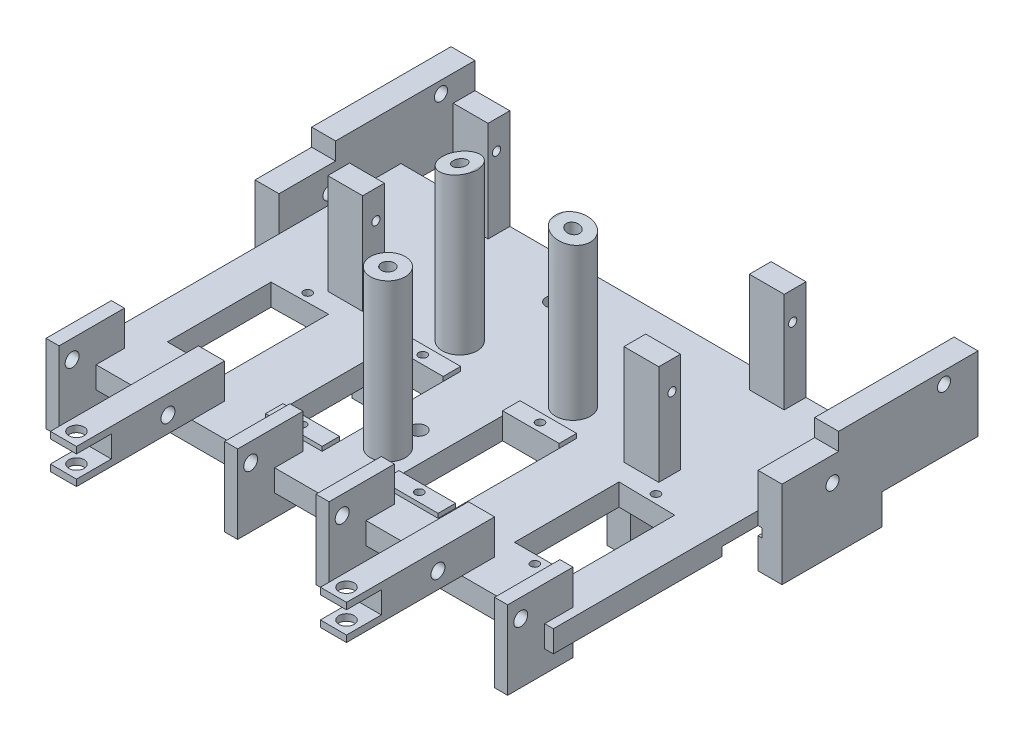
from build123d import *

# Parameters (mm, degrees)
SKETCH_1_W           = 110
SKETCH_1_H           = 75
EXTRUDE_1_DEPTH      = 5
SKETCH_4_W           = 105
SKETCH_4_H           = 28
EXTRUDE_4_DEPTH      = 5
SKETCH_5_W           = 23
SKETCH_5_H           = 20
EXTRUDE_5_DEPTH      = 5.5
SKETCH_6_W           = 32
SKETCH_6_H           = 17
EXTRUDE_6_DEPTH      = 5.5
SKETCH_8_W           = 8
SKETCH_8_H           = 5
EXTRUDE_7_DEPTH      = 23
EXTRUDE_START        = -10
SKETCH_9_W           = 3
SKETCH_9_H           = 15
EXTRUDE_8_DEPTH      = 18
SKETCH_10_W          = 3
SKETCH_10_H          = 15
EXTRUDE_9_DEPTH      = 18
SKETCH_11_W          = 6
SKETCH_11_H          = 34
EXTRUDE_10_DEPTH     = 8
SKETCH_12_R          = 4
EXTRUDE_11_DEPTH     = 36
CUT_EXTRUDE_8_REACH  = 122.108
SKETCH_19_R          = 0.95
SKETCH_25_R          = 4
EXTRUDE_14_DEPTH     = 36
CUT_EXTRUDE_14_DEPTH = 36
SKETCH_28_W          = 6
SKETCH_28_H          = 5
CUT_EXTRUDE_16_DEPTH = 8
SKETCH_29_R          = 1.75
CUT_EXTRUDE_17_DEPTH = 8
SKETCH_30_R          = 1.6
CUT_EXTRUDE_18_DEPTH = 48
SKETCH_31_R          = 1.75
CUT_EXTRUDE_19_DEPTH = 20
SKETCH_35_R          = 1.5
CUT_EXTRUDE_23_DEPTH = 15
SKETCH_36_R          = 0.95
SKETCH_36_W          = 13
SKETCH_36_H          = 23.8
CUT_EXTRUDE_24_DEPTH = 7
SKETCH_37_W          = 6
SKETCH_37_H          = 5
SKETCH_37_W_2        = 5.306431403
EXTRUDE_15_DEPTH     = 13
SKETCH_38_R          = 0.95
CUT_EXTRUDE_25_DEPTH = 13
SKETCH_43_W          = 37.306431403
SKETCH_43_H          = 36.277028663
SKETCH_43_W_2        = 5.306431403
SKETCH_43_H_2        = 5
SKETCH_43_W_3        = 6
CUT_EXTRUDE_28_DEPTH = 2
EXTRUDE_START_2      = 1
SKETCH_41_W          = 13
SKETCH_41_H          = 4
SKETCH_41_R          = 0.95
EXTRUDE_16_DEPTH     = 1
CUT_EXTRUDE_START    = -13
SKETCH_39_R          = 1.5
CUT_EXTRUDE_26_DEPTH = 55


with BuildPart() as part:
    # 草图1 → 凸台-拉伸1 (new body)
    with BuildSketch(Plane(origin=(0, 0, 0), x_dir=(1, 0, 0), z_dir=(0, 1, 0))):
        Rectangle(SKETCH_1_W, SKETCH_1_H)
    extrude(amount=EXTRUDE_1_DEPTH)

    # 草图4 → 凸台-拉伸4 (add)
    with BuildSketch(Plane(origin=(0, 5, 0), x_dir=(1, 0, 0), z_dir=(0, 1, 0))):
        with Locations((0, 23.5)):
            Rectangle(SKETCH_4_W, SKETCH_4_H)
    extrude(amount=-EXTRUDE_4_DEPTH)

    # 草图5 → 凸台-拉伸5 (add)
    with BuildSketch(Plane.ZY.offset(55)):
        with Locations((-21, 3)):
            Rectangle(SKETCH_5_W, SKETCH_5_H)
    extrude_5 = extrude(amount=EXTRUDE_5_DEPTH)

    # 草图6 → 凸台-拉伸6 (add)
    with BuildSketch(Plane.ZY.offset(55)):
        with Locations((-38.5, 8.5)):
            Rectangle(SKETCH_6_W, SKETCH_6_H)
    extrude_6 = extrude(amount=EXTRUDE_6_DEPTH)

    # 草图8 → 凸台-拉伸7 (add)
    with BuildSketch(Plane(origin=(0, 5, 0), x_dir=(1, 0, 0), z_dir=(0, 1, 0))):
        with Locations((-34, 35)):
            Rectangle(SKETCH_8_W, SKETCH_8_H)
        with Locations((-34, 6.2)):
            Rectangle(SKETCH_8_W, SKETCH_8_H)
    extrude_7 = extrude(amount=EXTRUDE_7_DEPTH)

    # 草图9 → 凸台-拉伸8 (add)
    with BuildSketch(Plane(origin=(0, 5, 0), x_dir=(1, 0, 0), z_dir=(0, 1, 0)).offset(EXTRUDE_START)):
        with Locations((-10.5, -38.5)):
            Rectangle(SKETCH_9_W, SKETCH_9_H)
    extrude_8 = extrude(amount=EXTRUDE_8_DEPTH)

    # 草图10 → 凸台-拉伸9 (add)
    with BuildSketch(Plane(origin=(0, 5, 0), x_dir=(1, 0, 0), z_dir=(0, 1, 0)).offset(EXTRUDE_START)):
        with Locations((-51.5, -38.5)):
            Rectangle(SKETCH_10_W, SKETCH_10_H)
    extrude_9 = extrude(amount=EXTRUDE_9_DEPTH)

    # 草图11 → 凸台-拉伸10 (add)
    with BuildSketch(Plane(origin=(0, 5, 0), x_dir=(1, 0, 0), z_dir=(0, 1, 0))):
        with Locations((-31, -47)):
            Rectangle(SKETCH_11_W, SKETCH_11_H)
    extrude_10 = extrude(amount=EXTRUDE_10_DEPTH)

    # 草图12 → 凸台-拉伸11 (add)
    with BuildSketch(Plane(origin=(0, 5, 0), x_dir=(1, 0, 0), z_dir=(0, 1, 0))):
        with Locations(Location((-13, 9, 0), (0, 0, 270))):
            Circle(SKETCH_12_R)
    extrude_11 = extrude(amount=EXTRUDE_11_DEPTH)

    # 草图19 → 切除-拉伸8 (cut, up to next)
    with BuildSketch(Plane.ZY.offset(38), mode=Mode.PRIVATE) as cut_extrude_8_sk1:
        with Locations((-6.75, 21.5)):
            Circle(SKETCH_19_R)
    cut_extrude_8_tool1 = extrude(cut_extrude_8_sk1.sketch, amount=-CUT_EXTRUDE_8_REACH, mode=Mode.PRIVATE) & part.part
    # 草图19 → 切除-拉伸8 (cut, up to next)
    with BuildSketch(Plane.ZY.offset(38), mode=Mode.PRIVATE) as cut_extrude_8_sk2:
        with Locations((-34.45, 21.5)):
            Circle(SKETCH_19_R)
    cut_extrude_8_tool2 = extrude(cut_extrude_8_sk2.sketch, amount=-CUT_EXTRUDE_8_REACH, mode=Mode.PRIVATE) & part.part
    cut_extrude_8_1 = cut_extrude_8_tool1.solids().sort_by_distance((-38, 21.5, -6.75))[0]
    add(cut_extrude_8_1, mode=Mode.SUBTRACT)
    cut_extrude_8_2 = cut_extrude_8_tool2.solids().sort_by_distance((-38, 21.5, -34.45))[0]
    add(cut_extrude_8_2, mode=Mode.SUBTRACT)
    cut_extrude_8 = cut_extrude_8_1 + cut_extrude_8_2  # 切除-拉伸8 as one shape, for the pattern or mirror that repeats it

    # 草图25 → 凸台-拉伸14 (add)
    with BuildSketch(Plane(origin=(0, 5, 0), x_dir=(1, 0, 0), z_dir=(0, 1, 0))):
        with Locations(Location((0, -20.5, 0), (0, 0, 270))):
            Circle(SKETCH_25_R)
    extrude(amount=EXTRUDE_14_DEPTH)

    # 草图26 → 切除-拉伸14 (cut)
    with BuildSketch(Plane.XY):
        Polygon((-17, 41), (-17, 39.644045518), (-9.31, 41), align=None)
    cut_extrude_14 = extrude(amount=-CUT_EXTRUDE_14_DEPTH, mode=Mode.SUBTRACT)

    # 草图28 → 切除-拉伸16 (cut)
    with BuildSketch(Plane.XY.offset(64)):
        with Locations((-31, 9)):
            Rectangle(SKETCH_28_W, SKETCH_28_H)
    cut_extrude_16 = extrude(amount=-CUT_EXTRUDE_16_DEPTH, mode=Mode.SUBTRACT)

    # 草图29 → 切除-拉伸17 (cut)
    with BuildSketch(Plane(origin=(0, 13, 0), x_dir=(1, 0, 0), z_dir=(0, 1, 0))):
        with Locations(Location((-31, -61, 0), (0, 0, 270))):
            Circle(SKETCH_29_R)
    cut_extrude_17 = extrude(amount=-CUT_EXTRUDE_17_DEPTH, mode=Mode.SUBTRACT)

    # 草图30 → 切除-拉伸18 (cut)
    with BuildSketch(Plane.ZY.offset(53)):
        with Locations((43, 8.75)):
            Circle(SKETCH_30_R)
    cut_extrude_18 = extrude(amount=-CUT_EXTRUDE_18_DEPTH, mode=Mode.SUBTRACT)

    # 草图31 → 切除-拉伸19 (cut)
    with BuildSketch(Plane(origin=(0, 5, 0), x_dir=(1, 0, 0), z_dir=(0, 1, 0))):
        with Locations(Location((0, -13.5, 0), (0, 0, 270))):
            Circle(SKETCH_31_R)
        with Locations(Location((-10, 27.5, 0), (0, 0, 270))):
            Circle(SKETCH_31_R)
        with Locations(Location((10, 27.5, 0), (0, 0, 270))):
            Circle(SKETCH_31_R)
    extrude(amount=-CUT_EXTRUDE_19_DEPTH, mode=Mode.SUBTRACT)

    # 草图35 → 切除-拉伸23 (cut)
    with BuildSketch(Plane.ZY.offset(60.5)):
        with Locations((-46.690639003, 14.263935089)):
            Circle(SKETCH_35_R)
        with Locations((-21.089366767, 7.437765567)):
            Circle(SKETCH_35_R)
    cut_extrude_23 = extrude(amount=-CUT_EXTRUDE_23_DEPTH, mode=Mode.SUBTRACT)

    # 草图36 → 切除-拉伸24 (cut)
    with BuildSketch(Plane(origin=(0, 5, 0), x_dir=(1, 0, 0), z_dir=(0, 1, 0))):
        with Locations(Location((-13.450764078, 0.968101862, 0), (0, 0, 270))):
            Circle(SKETCH_36_R)
        with Locations(Location((-13.450764078, -26.731898138, 0), (0, 0, 270))):
            Circle(SKETCH_36_R)
        with Locations(Location((-39.980852572, -26.731898138, 0), (0, 0, 270))):
            Circle(SKETCH_36_R)
        with Locations(Location((-39.98003787, 1.073911603, 0), (0, 0, 270))):
            Circle(SKETCH_36_R)
        with Locations((-13.315810377, -12.881898138)):
            Rectangle(SKETCH_36_W, SKETCH_36_H)
        Polygon((-33.347062743, -0.766375386), (-33.347062743, -24.781898138), (-46.345897091, -24.781898138), (-46.345276079, -0.981898147), align=None)
    cut_extrude_24 = extrude(amount=-CUT_EXTRUDE_24_DEPTH, mode=Mode.SUBTRACT)

    # 草图37 → 凸台-拉伸15 (add)
    with BuildSketch(Plane.XZ):
        with Locations((-29.638562747, -34.522971337)):
            Rectangle(SKETCH_37_W, SKETCH_37_H)
        with Locations((-29.291778449, -5.722971337)):
            Rectangle(SKETCH_37_W_2, SKETCH_37_H)
    extrude_15 = extrude(amount=EXTRUDE_15_DEPTH)

    # 草图38 → 切除-拉伸25 (cut)
    with BuildSketch(Plane.ZY.offset(32.638562747)):
        with Locations((-33.972971337, -4.5)):
            Circle(SKETCH_38_R)
        with Locations((-6.272971337, -4.5)):
            Circle(SKETCH_38_R)
    cut_extrude_25 = extrude(amount=-CUT_EXTRUDE_25_DEPTH, mode=Mode.SUBTRACT)

    # 草图43 → 切除-拉伸28 (cut)
    with BuildSketch(Plane.XZ):
        with Locations((-37.291778449, -19.361485668)):
            Rectangle(SKETCH_43_W, SKETCH_43_H)
        with Locations((-29.291778449, -5.722971337)):
            Rectangle(SKETCH_43_W_2, SKETCH_43_H_2, mode=Mode.SUBTRACT)
        with Locations((-29.638562747, -34.522971337)):
            Rectangle(SKETCH_43_W_3, SKETCH_43_H_2, mode=Mode.SUBTRACT)
    cut_extrude_28 = extrude(amount=-CUT_EXTRUDE_28_DEPTH, mode=Mode.SUBTRACT)

    # 草图41 → 凸台-拉伸16 (add)
    # profile 1 of 2: a face of its own
    with BuildSketch(Plane(origin=(0, 5, 0), x_dir=(1, 0, 0), z_dir=(0, 1, 0)).offset(EXTRUDE_START_2)):
        with Locations((-13.315810377, 1.018101862)):
            Rectangle(SKETCH_41_W, SKETCH_41_H)
        with Locations(Location((-13.450764078, 0.968101862, 0), (0, 0, 270))):
            Circle(SKETCH_41_R, mode=Mode.SUBTRACT)
    # profile 2 of 2: a face of its own
    with BuildSketch(Plane(origin=(0, 5, 0), x_dir=(1, 0, 0), z_dir=(0, 1, 0)).offset(EXTRUDE_START_2)):
        with Locations((-13.315810377, -26.781898138)):
            Rectangle(SKETCH_41_W, SKETCH_41_H)
        with Locations(Location((-13.450764078, -26.731898138, 0), (0, 0, 270))):
            Circle(SKETCH_41_R, mode=Mode.SUBTRACT)
    extrude_16 = extrude(amount=-EXTRUDE_16_DEPTH)

    # 草图39 → 切除-拉伸26 (cut)
    with BuildSketch(Plane(origin=(0, 5, 0), x_dir=(1, 0, 0), z_dir=(0, 1, 0)).offset(CUT_EXTRUDE_START)):
        with Locations(Location((-13, 9, 0), (0, 0, 180))):
            Circle(SKETCH_39_R)
        with Locations(Location((0, -20.5, 0), (0, 0, 270))):
            Circle(SKETCH_39_R)
    cut_extrude_26 = extrude(amount=CUT_EXTRUDE_26_DEPTH, mode=Mode.SUBTRACT)

    # 镜向1: 凸台-拉伸5, 凸台-拉伸6, 凸台-拉伸7, 凸台-拉伸8, 凸台-拉伸9, 凸台-拉伸10, 凸台-拉伸11, 切除-拉伸8, 切除-拉伸14, 切除-拉伸16, 切除-拉伸17, 切除-拉伸18, 切除-拉伸23, 切除-拉伸24, 凸台-拉伸15, 切除-拉伸25, 切除-拉伸28, 凸台-拉伸16, 切除-拉伸26 across plane
    add(extrude_5.mirror(Plane(origin=(0, 0, 0), x_dir=(0, 0, 1), z_dir=(1, 0, 0))))
    add(extrude_6.mirror(Plane(origin=(0, 0, 0), x_dir=(0, 0, 1), z_dir=(1, 0, 0))))
    add(extrude_7.mirror(Plane(origin=(0, 0, 0), x_dir=(0, 0, 1), z_dir=(1, 0, 0))))
    add(extrude_8.mirror(Plane(origin=(0, 0, 0), x_dir=(0, 0, 1), z_dir=(1, 0, 0))))
    add(extrude_9.mirror(Plane(origin=(0, 0, 0), x_dir=(0, 0, 1), z_dir=(1, 0, 0))))
    add(extrude_10.mirror(Plane(origin=(0, 0, 0), x_dir=(0, 0, 1), z_dir=(1, 0, 0))))
    add(extrude_11.mirror(Plane(origin=(0, 0, 0), x_dir=(0, 0, 1), z_dir=(1, 0, 0))))
    add(cut_extrude_8.mirror(Plane(origin=(0, 0, 0), x_dir=(0, 0, 1), z_dir=(1, 0, 0))), mode=Mode.SUBTRACT)
    add(cut_extrude_14.mirror(Plane(origin=(0, 0, 0), x_dir=(0, 0, 1), z_dir=(1, 0, 0))), mode=Mode.SUBTRACT)
    add(cut_extrude_16.mirror(Plane(origin=(0, 0, 0), x_dir=(0, 0, 1), z_dir=(1, 0, 0))), mode=Mode.SUBTRACT)
    add(cut_extrude_17.mirror(Plane(origin=(0, 0, 0), x_dir=(0, 0, 1), z_dir=(1, 0, 0))), mode=Mode.SUBTRACT)
    add(cut_extrude_18.mirror(Plane(origin=(0, 0, 0), x_dir=(0, 0, 1), z_dir=(1, 0, 0))), mode=Mode.SUBTRACT)
    add(cut_extrude_23.mirror(Plane(origin=(0, 0, 0), x_dir=(0, 0, 1), z_dir=(1, 0, 0))), mode=Mode.SUBTRACT)
    add(cut_extrude_24.mirror(Plane(origin=(0, 0, 0), x_dir=(0, 0, 1), z_dir=(1, 0, 0))), mode=Mode.SUBTRACT)
    add(extrude_15.mirror(Plane(origin=(0, 0, 0), x_dir=(0, 0, 1), z_dir=(1, 0, 0))))
    add(cut_extrude_25.mirror(Plane(origin=(0, 0, 0), x_dir=(0, 0, 1), z_dir=(1, 0, 0))), mode=Mode.SUBTRACT)
    add(cut_extrude_28.mirror(Plane(origin=(0, 0, 0), x_dir=(0, 0, 1), z_dir=(1, 0, 0))), mode=Mode.SUBTRACT)
    add(extrude_16.mirror(Plane(origin=(0, 0, 0), x_dir=(0, 0, 1), z_dir=(1, 0, 0))))
    add(cut_extrude_26.mirror(Plane(origin=(0, 0, 0), x_dir=(0, 0, 1), z_dir=(1, 0, 0))), mode=Mode.SUBTRACT)


solid = part.part
